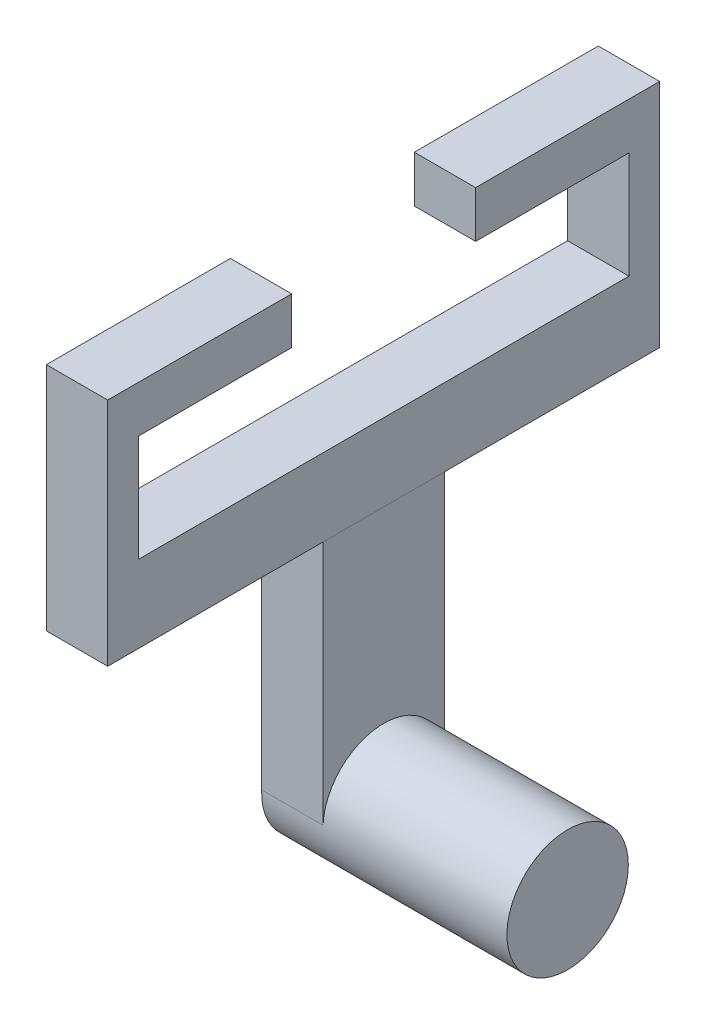
from build123d import *

# Parameters (mm, degrees)
SKETCH2_R       = 12.573
FEATURE_A_DEPTH = 50.8
SKETCH3_W       = 25.146
SKETCH3_H       = 50.8
FEATURE_B_DEPTH = 12.7
SKETCH5_W       = 101.6
SKETCH5_H       = 16.002
FEATURE_C_DEPTH = 12.7
SKETCH10_W      = 6.35
SKETCH10_H      = 38.1
FEATURE_D_DEPTH = 12.7
SKETCH11_W      = 38.1
SKETCH11_H      = 9.652
FEATURE_E_DEPTH = 12.7


with BuildPart() as part:
    # Sketch2 → Feature A (new body)
    with BuildSketch(Plane(origin=(0, 0, 0), x_dir=(0, 0, -1), z_dir=(1, 0, 0))):
        Circle(SKETCH2_R)
    extrude(amount=FEATURE_A_DEPTH)

    # Sketch3 → Feature B (add)
    with BuildSketch(Plane.ZY):
        with Locations((0.014451225, 26.002645546)):
            Rectangle(SKETCH3_W, SKETCH3_H)
    extrude(amount=-FEATURE_B_DEPTH)


with BuildPart() as body_2:
    # Sketch5 → Feature C (new body)
    with BuildSketch(Plane(origin=(0, 0, 0), x_dir=(0, 0, -1), z_dir=(1, 0, 0))):
        with Locations((0, 59.392294155)):
            Rectangle(SKETCH5_W, SKETCH5_H)
    extrude(amount=FEATURE_C_DEPTH)

    # Sketch10 → Feature D (add, through all)
    with BuildSketch(Plane(origin=(12.7, 0, 0), x_dir=(0, 0, -1), z_dir=(1, 0, 0))):
        with Locations((-53.975, 70.441294155)):
            Rectangle(SKETCH10_W, SKETCH10_H)
        with Locations((53.975, 70.441294155)):
            Rectangle(SKETCH10_W, SKETCH10_H)
    extrude(amount=-FEATURE_D_DEPTH)

    # Sketch11 → Feature E (add, through all)
    with BuildSketch(Plane(origin=(12.7, 0, 0), x_dir=(0, 0, -1), z_dir=(1, 0, 0))):
        with Locations((-38.1, 94.317294155)):
            Rectangle(SKETCH11_W, SKETCH11_H)
        with Locations((38.1, 94.317294155)):
            Rectangle(SKETCH11_W, SKETCH11_H)
    extrude(amount=-FEATURE_E_DEPTH)


solid = Compound([part.part, body_2.part])
